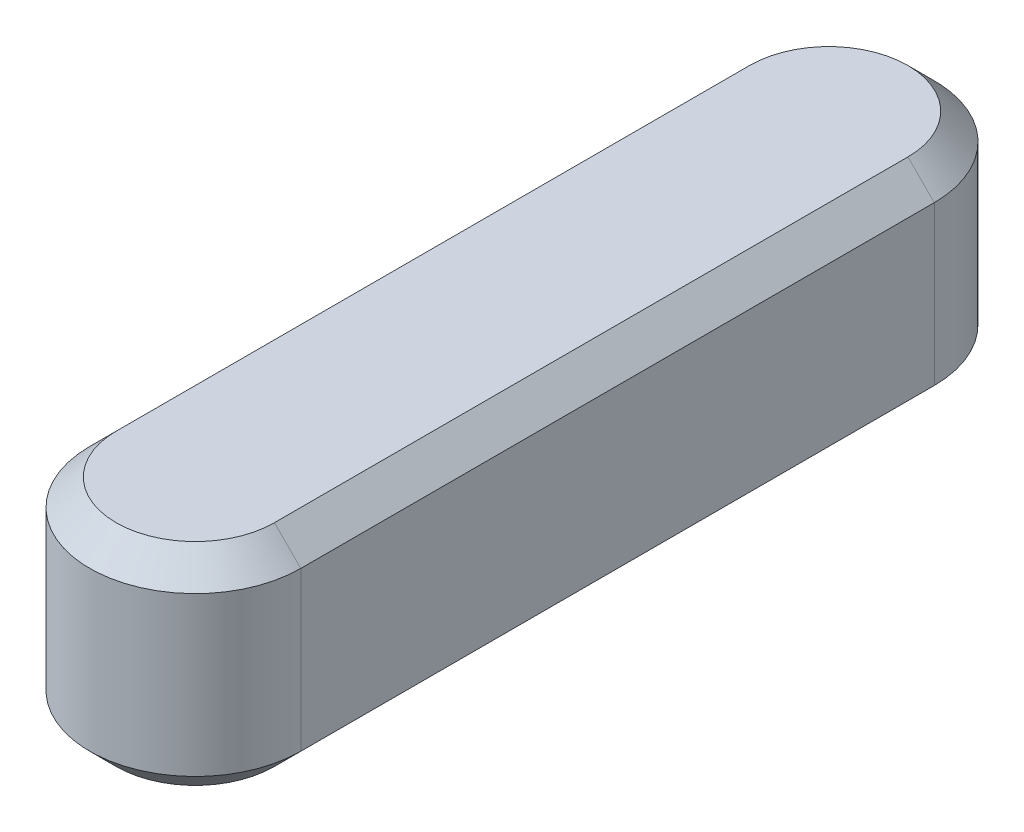
from build123d import *

# Parameters (mm, degrees)
VYSUNOUT1_DEPTH = 1
ZKOSIT1_SIZE    = 0.25


with BuildPart() as part:
    # Skica1 → Vysunout1 (new, symmetric)
    with BuildSketch(Plane(origin=(0, 0, 0), x_dir=(1, 0, 0), z_dir=(0, 1, 0))):
        with BuildLine():
            Line((-1, 3), (-1, -3))
            ThreePointArc((-1, -3), (0, -4), (1, -3))
            Line((1, -3), (1, 3))
            ThreePointArc((1, 3), (0, 4), (-1, 3))
        make_face()
    extrude(amount=VYSUNOUT1_DEPTH, both=True)

    # Zkosit1
    zkosit1_edges = [part.edges().sort_by_distance(p)[0] for p in [
        (0, 1, 4),
        (1, 1, 0),
        (0, 1, -4),
        (1, -1, 0),
        (0, -1, 4),
        (-1, -1, 0),
        (0, -1, -4),
        (-1, 1, 0),
    ]]
    chamfer(zkosit1_edges, length=ZKOSIT1_SIZE)


solid = part.part
